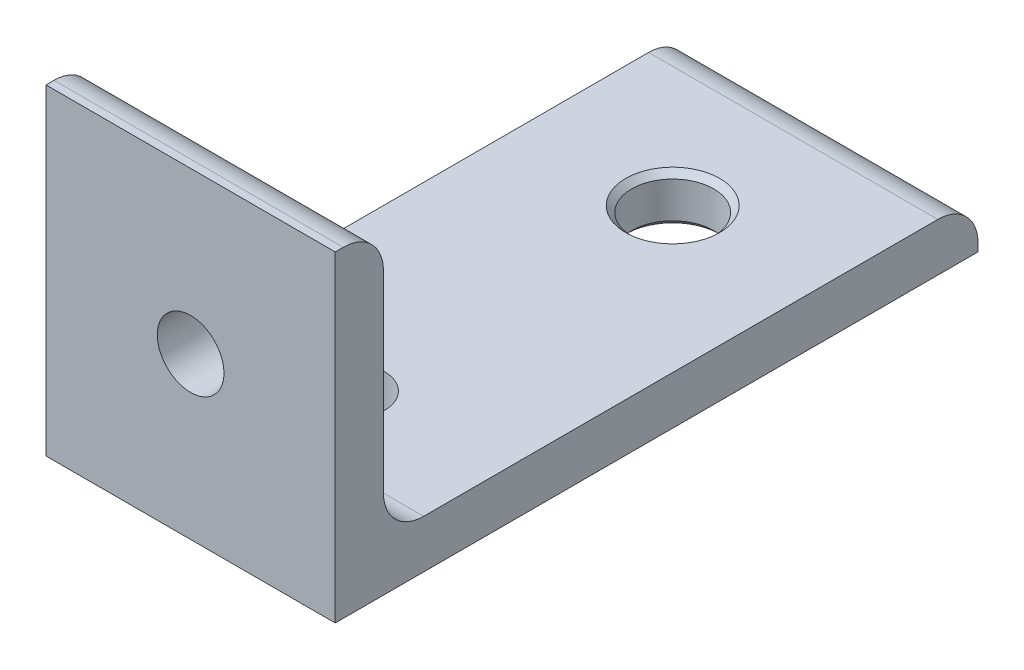
from build123d import *

# Parameters (mm, degrees)
BOSS_EXTRUDE1_DEPTH = 18
SKETCH2_R           = 5.1
SKETCH2_R_2         = 4.15
CUT_EXTRUDE1_DEPTH  = 89.769364085
SKETCH3_R           = 4.15
CUT_EXTRUDE2_DEPTH  = 87.02325267
FILLET1_R           = 5
CHAMFER1_SIZE       = 0.75


with BuildPart() as part:
    # Sketch1 → Boss-Extrude1 (new, symmetric)
    with BuildSketch(Plane(origin=(0, 0, 0), x_dir=(0, 0, -1), z_dir=(1, 0, 0))):
        Polygon((0, 40), (0, 0), (80, 0), (80, 6), (6, 6), (6, 40), align=None)
    extrude(amount=BOSS_EXTRUDE1_DEPTH, both=True)

    # Sketch2 → Cut-Extrude1 (cut, through all)
    with BuildSketch(Plane(origin=(0, 6, 0), x_dir=(1, 0, 0), z_dir=(0, 1, 0))):
        with Locations(Location((0, 60, 0), (0, 0, 270))):
            Circle(SKETCH2_R)
        with Locations(Location((0, 20, 0), (0, 0, 270))):
            Circle(SKETCH2_R_2)
    extrude(amount=-CUT_EXTRUDE1_DEPTH, mode=Mode.SUBTRACT)

    # Sketch3 → Cut-Extrude2 (cut, through all)
    with BuildSketch(Plane(origin=(0, 0, -6), x_dir=(-1, 0, 0), z_dir=(0, 0, -1))):
        with Locations((0, 20)):
            Circle(SKETCH3_R)
    extrude(amount=-CUT_EXTRUDE2_DEPTH, mode=Mode.SUBTRACT)

    # Fillet1
    fillet1_edges = [part.edges().sort_by_distance(p)[0] for p in [
        (0, 40, -6),
        (0, 6, -6),
        (0, 6, -80),
    ]]
    fillet(fillet1_edges, radius=FILLET1_R)

    # Chamfer1
    chamfer1_edges = [part.edges().sort_by_distance(p)[0] for p in [
        (0, 0, -65.1),
        (0, 6, -65.1),
    ]]
    chamfer(chamfer1_edges, length=CHAMFER1_SIZE)


solid = part.part
